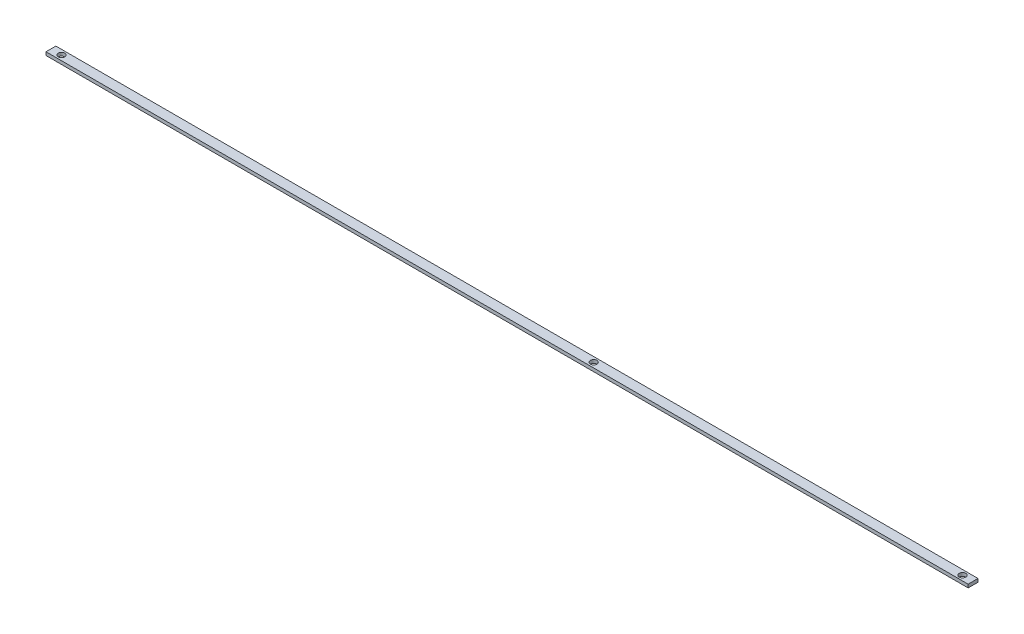
from build123d import *

# Parameters (mm, degrees)
SKETCH1_W           = 889
SKETCH1_H           = 9.525
BOSS_EXTRUDE1_DEPTH = 3.175
SKETCH2_R           = 3.175
CUT_EXTRUDE1_DEPTH  = 6.35


with BuildPart() as part:
    # Sketch1 → Boss-Extrude1 (new body)
    with BuildSketch(Plane(origin=(0, 0, 0), x_dir=(1, 0, 0), z_dir=(0, 1, 0))):
        with Locations((399.966952656, 4.7625)):
            Rectangle(SKETCH1_W, SKETCH1_H)
    extrude(amount=BOSS_EXTRUDE1_DEPTH)

    # Sketch2 → Cut-Extrude1 (cut)
    with BuildSketch(Plane(origin=(0, 3.175, 0), x_dir=(1, 0, 0), z_dir=(0, 1, 0))):
        with Locations(Location((-34.373047344, 4.7625, 0), (0, 0, 270))):
            Circle(SKETCH2_R)
        with Locations(Location((834.306952656, 4.7625, 0), (0, 0, 270))):
            Circle(SKETCH2_R)
        with Locations(Location((478.706952656, 4.7625, 0), (0, 0, 270))):
            Circle(SKETCH2_R)
    extrude(amount=-CUT_EXTRUDE1_DEPTH, mode=Mode.SUBTRACT)


solid = part.part
